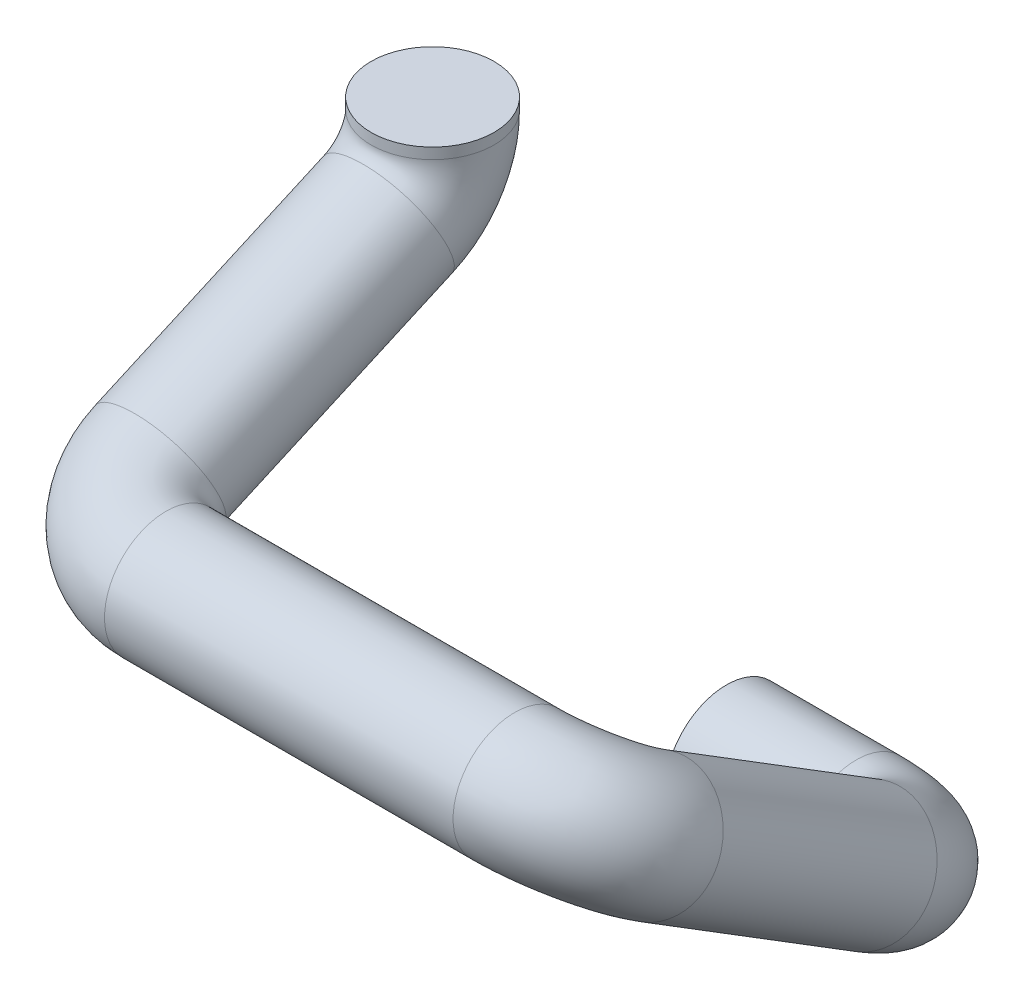
from build123d import *

# Parameters (mm, degrees)
SKETCH_8_R = 9


with BuildPart() as part:
    # 扫描5: sweep along a curve in space
    with BuildLine() as sweep_5_path:
        Line((0, 62, 0), (0, 60.404917791, 0))
        ThreePointArc((0, 60.404917791, 0), (0, 54.413888405, 1.774623753), (0, 50.355917757, 6.525896926))
        Line((0, 50.355917757, 6.525896926), (0, 35.474103074, 39.950999966))
        ThreePointArc((0, 35.474103074, 39.950999966), (3.221825407, 32.310434451, 47.056716034), (11, 31, 50))
        Line((11, 31, 50), (62, 31, 50))
        ThreePointArc((62, 31, 50), (69.778174593, 29.302292387, 47.261761914), (73, 25.203663643, 40.651070391))
        Line((73, 25.203663643, 40.651070391), (73, 5.796336357, 9.348929609))
        ThreePointArc((73, 5.796336357, 9.348929609), (69.778174593, 1.697707613, 2.738238086), (62, 0, 0))
        Line((62, 0, 0), (43, 0, 0))
    # 草图8 → 扫描5 (sweep)
    with BuildSketch(Plane(origin=(0, 62, 0), x_dir=(1, 0, 0), z_dir=(0, 1, 0))):
        Circle(SKETCH_8_R)
    sweep(path=sweep_5_path.line)


solid = part.part
